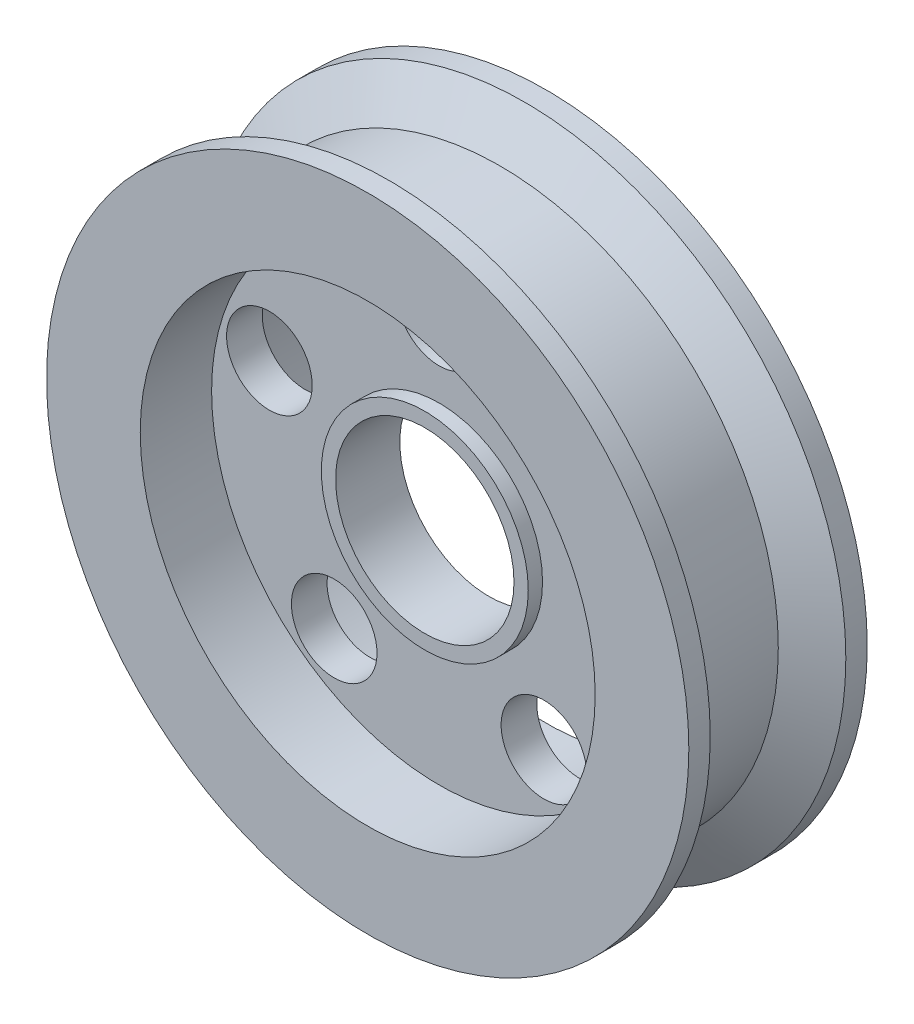
from build123d import *

# Parameters (mm, degrees)
SKETCH1_R                = 45
SKETCH1_R_2              = 12.5
BOSS_EXTRUDE1_DEPTH      = 12.5
SKETCH2_R                = 31.875
CUT_EXTRUDE1_DEPTH       = 10
SKETCH3_R                = 6
CUT_EXTRUDE2_DEPTH       = 66.383484153
CIRPATTERN1_COUNT        = 5
BOSS_EXTRUDE2_DEPTH      = 2
BOSS_EXTRUDE2_DEPTH_BACK = 7
SKETCH4_R                = 14.5
SKETCH4_R_2              = 12.5


with BuildPart() as part:
    # Sketch1 → Boss-Extrude1 (new, symmetric)
    with BuildSketch(Plane.XY):
        Circle(SKETCH1_R)
        Circle(SKETCH1_R_2, mode=Mode.SUBTRACT)
    extrude(amount=BOSS_EXTRUDE1_DEPTH, both=True)

    # Sketch2 → Cut-Extrude1 (cut)
    with BuildSketch(Plane.XY.offset(12.5)):
        Circle(SKETCH2_R)
    cut_extrude1 = extrude(amount=-CUT_EXTRUDE1_DEPTH, mode=Mode.SUBTRACT)

    # Mirror1: Cut-Extrude1 across plane
    add(cut_extrude1.mirror(Plane.XY), mode=Mode.SUBTRACT)

    # Sketch3 → Cut-Extrude2 (cut, through all)
    with BuildSketch(Plane.XY.offset(2.5)):
        with Locations((0, 25)):
            Circle(SKETCH3_R)
    cut_extrude2 = extrude(amount=-CUT_EXTRUDE2_DEPTH, mode=Mode.SUBTRACT)

    # CirPattern1: Cut-Extrude2 ×5 about axis
    cirpattern1_axis = Axis((0, 0, 0), (0, 0, 1))
    for i in range(1, CIRPATTERN1_COUNT):
        add(cut_extrude2.rotate(cirpattern1_axis, i * 360 / CIRPATTERN1_COUNT), mode=Mode.SUBTRACT)

    # Sketch4 → Boss-Extrude2 (add, two sides: drawn at the far end of the back side and taken through both)
    with BuildSketch(Plane.XY.offset(2.5).offset(-BOSS_EXTRUDE2_DEPTH_BACK)):
        Circle(SKETCH4_R)
        Circle(SKETCH4_R_2, mode=Mode.SUBTRACT)
    extrude(amount=BOSS_EXTRUDE2_DEPTH + BOSS_EXTRUDE2_DEPTH_BACK)

    # Sketch5 → Cut-Revolve1 (revolve, cut)
    with BuildSketch(Plane(origin=(0, 0, 0), x_dir=(1, 0, 0), z_dir=(0, 1, 0))):
        Polygon((45, 9.5), (39, 6.035898385), (39, -6.035898385), (45, -9.5), align=None)
    revolve(axis=Axis((0, 0, 0), (0, 0, -1)), mode=Mode.SUBTRACT)


solid = part.part
